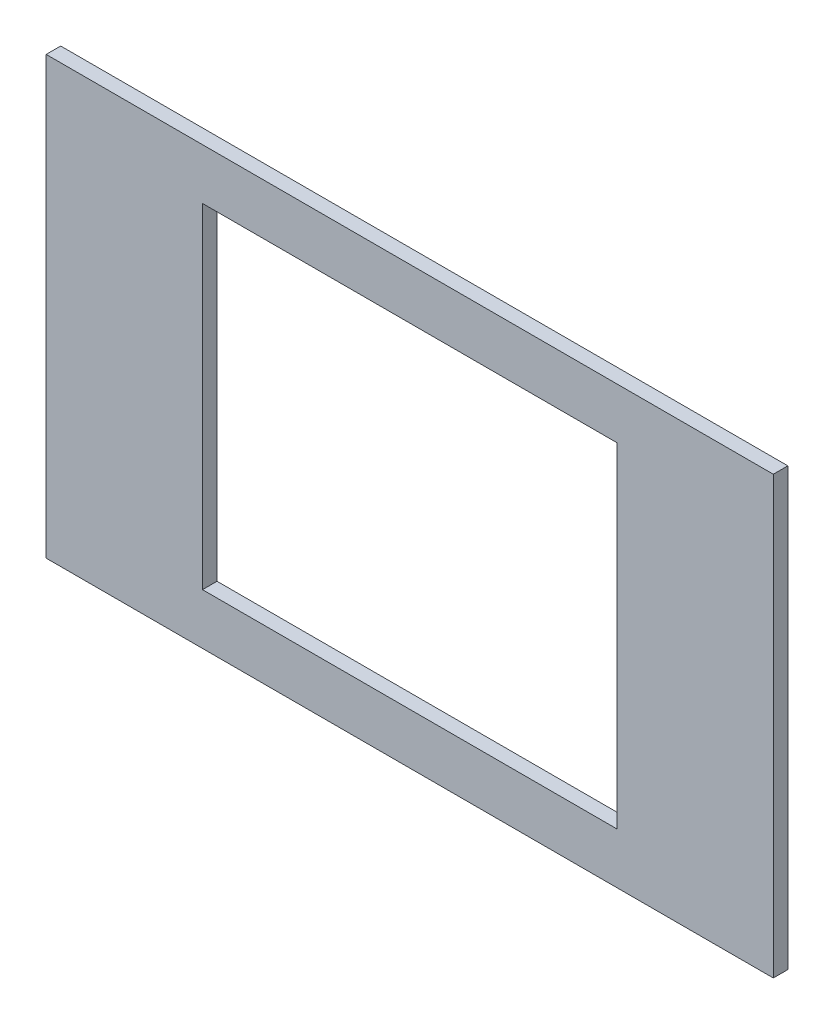
from build123d import *

# Parameters (mm, degrees)
SKETCH1_W                   = 127
SKETCH1_H                   = 76.2
MAIN_BODY_DEPTH             = 2.54
SKETCH2_W                   = 72.39
SKETCH2_H                   = 58.42
HOLE_FOR_CIRCUITBOARD_DEPTH = 2.54


with BuildPart() as part:
    # Sketch1 → main body (new body)
    with BuildSketch(Plane.XY):
        Rectangle(SKETCH1_W, SKETCH1_H)
    extrude(amount=MAIN_BODY_DEPTH)

    # Sketch2 → hole for circuitboard (cut)
    with BuildSketch(Plane.XY.offset(2.54)):
        Rectangle(SKETCH2_W, SKETCH2_H)
    extrude(amount=-HOLE_FOR_CIRCUITBOARD_DEPTH, mode=Mode.SUBTRACT)


solid = part.part
